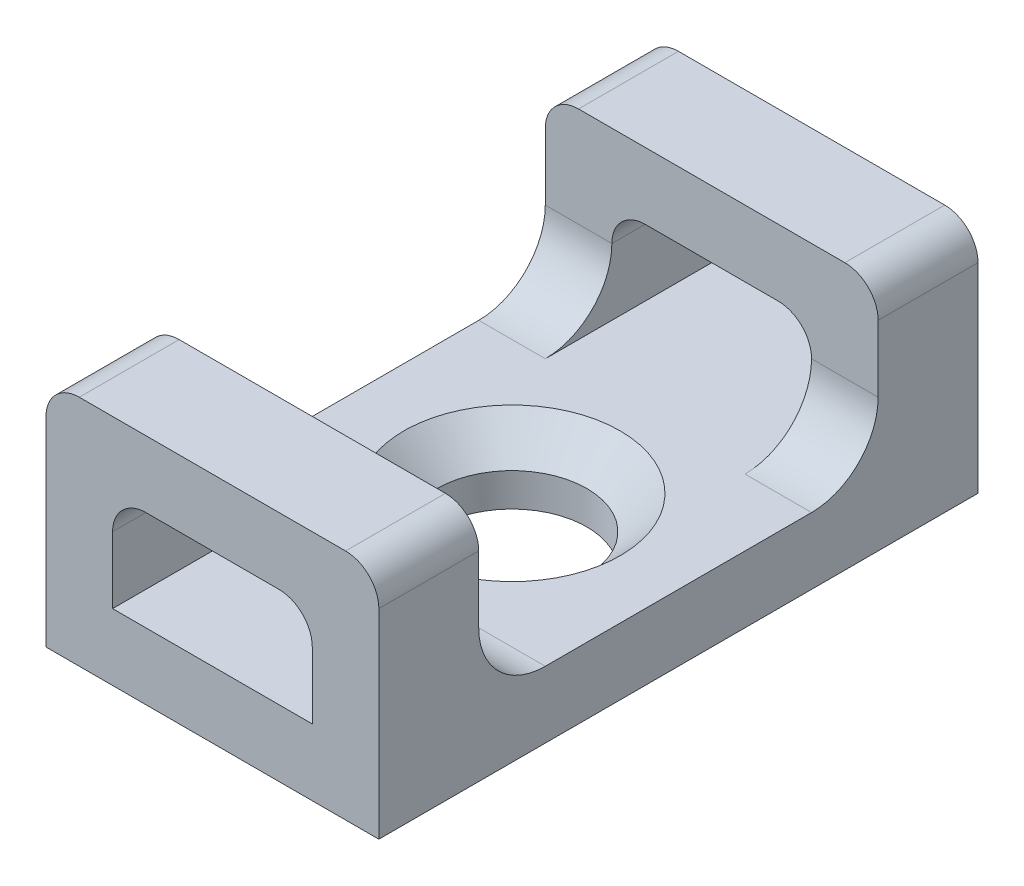
from build123d import *

# Parameters (mm, degrees)
SKETCH_1_W          = 10
SKETCH_1_H          = 18
EXTRUDE_1_DEPTH     = 2
SKETCH_2_R          = 2.25
CUT_EXTRUDE_1_DEPTH = 2
EXTRUDE_2_DEPTH     = 3
CHAMFER_1_SIZE      = 1
EXTRUDE_START       = -18
EXTRUDE_3_DEPTH     = 3
FILLET_1_R          = 2


with BuildPart() as part:
    # Эскиз1 → Бобышка-Вытянуть1 (new body)
    with BuildSketch(Plane(origin=(0, 0, 0), x_dir=(1, 0, 0), z_dir=(0, 1, 0))):
        with Locations((5, 9)):
            Rectangle(SKETCH_1_W, SKETCH_1_H)
    extrude(amount=EXTRUDE_1_DEPTH)

    # Эскиз2 → Вырез-Вытянуть1 (cut)
    with BuildSketch(Plane(origin=(0, 2, 0), x_dir=(1, 0, 0), z_dir=(0, 1, 0))):
        with Locations(Location((5, 9, 0), (0, 0, 270))):
            Circle(SKETCH_2_R)
    extrude(amount=-CUT_EXTRUDE_1_DEPTH, mode=Mode.SUBTRACT)

    # Эскиз4 → Бобышка-Вытянуть2 (add)
    with BuildSketch(Plane.XY):
        with BuildLine():
            Line((0, 6), (0, 2))
            Line((0, 2), (2, 2))
            Line((2, 2), (2, 4))
            ThreePointArc((2, 4), (2.292893219, 4.707106781), (3, 5))
            Line((3, 5), (7, 5))
            ThreePointArc((7, 5), (7.707106781, 4.707106781), (8, 4))
            Line((8, 4), (8, 2))
            Line((8, 2), (10, 2))
            Line((10, 2), (10, 6))
            ThreePointArc((10, 6), (9.707106781, 6.707106781), (9, 7))
            Line((9, 7), (8, 7))
            Line((8, 7), (2, 7))
            Line((2, 7), (1, 7))
            ThreePointArc((1, 7), (0.292893219, 6.707106781), (0, 6))
        make_face()
    extrude(amount=-EXTRUDE_2_DEPTH)

    # Фаска1
    chamfer_1_edges = [part.edges().sort_by_distance(p)[0] for p in [
        (5, 2, -11.25),
    ]]
    chamfer(chamfer_1_edges, length=CHAMFER_1_SIZE)

    # Эскиз4<3> → Бобышка-Вытянуть3 (add)
    with BuildSketch(Plane.XY.offset(EXTRUDE_START)):
        with BuildLine():
            Line((0, 2), (2, 2))
            Line((2, 2), (2, 4))
            ThreePointArc((2, 4), (2.292893219, 4.707106781), (3, 5))
            Line((3, 5), (7, 5))
            ThreePointArc((7, 5), (7.707106781, 4.707106781), (8, 4))
            Line((8, 4), (8, 2))
            Line((8, 2), (10, 2))
            Line((10, 2), (10, 6))
            ThreePointArc((10, 6), (9.707106781, 6.707106781), (9, 7))
            Line((9, 7), (8, 7))
            Line((8, 7), (2, 7))
            Line((2, 7), (1, 7))
            ThreePointArc((1, 7), (0.292893219, 6.707106781), (0, 6))
            Line((0, 6), (0, 2))
        make_face()
    extrude(amount=EXTRUDE_3_DEPTH)

    # Скругление1
    fillet_1_edges = [part.edges().sort_by_distance(p)[0] for p in [
        (9, 2, -3),
        (1, 2, -3),
        (1, 2, -15),
        (9, 2, -15),
    ]]
    fillet(fillet_1_edges, radius=FILLET_1_R)


solid = part.part
